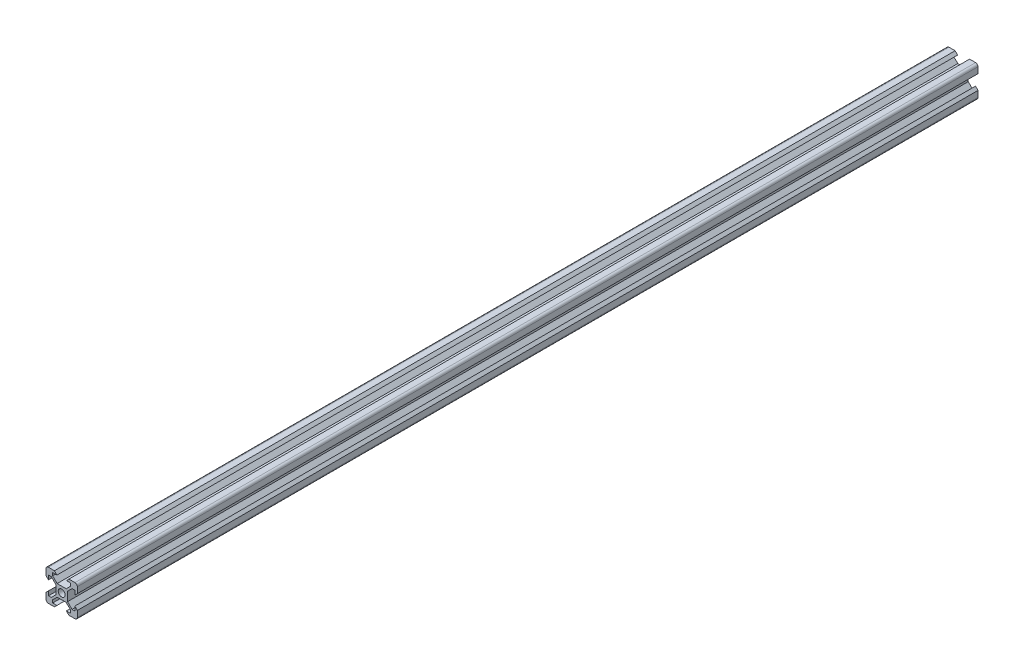
from build123d import *

# Parameters (mm, degrees)
SKETCH1_W           = 15.088
SKETCH1_H           = 15.088
SKETCH1_R           = 4.4
BOSS_EXTRUDE1_DEPTH = 575


with BuildPart() as part:
    # Sketch1 → Boss-Extrude1 (new, symmetric)
    # profile 1 of 5: a face of its own
    with BuildSketch(Plane.XY):
        with BuildLine():
            Line((-7.544, 7.544), (-5.784718328, 7.544))
            Line((-5.784718328, 7.544), (-11.512, 13.271281672))
            Line((-11.512, 13.271281672), (-11.512, 16.8))
            Line((-11.512, 16.8), (-6.051976926, 16.8))
            Line((-6.051976926, 16.8), (-9.251976926, 20))
            Line((-9.251976926, 20), (-17, 20))
            ThreePointArc((-17, 20), (-19.121320344, 19.121320344), (-20, 17))
            Line((-20, 17), (-20, 9.251976926))
            Line((-20, 9.251976926), (-16.8, 6.051976926))
            Line((-16.8, 6.051976926), (-16.8, 11.512))
            Line((-16.8, 11.512), (-13.271281672, 11.512))
            Line((-13.271281672, 11.512), (-7.544, 5.784718328))
            Line((-7.544, 5.784718328), (-7.544, 7.544))
        make_face()
    # profile 2 of 5: a face of its own
    with BuildSketch(Plane.XY):
        with BuildLine():
            Line((11.512, 13.271281672), (5.784718328, 7.544))
            Line((5.784718328, 7.544), (7.544, 7.544))
            Line((7.544, 7.544), (7.544, 5.784718328))
            Line((7.544, 5.784718328), (13.271281672, 11.512))
            Line((13.271281672, 11.512), (16.8, 11.512))
            Line((16.8, 11.512), (16.8, 6.051976926))
            Line((16.8, 6.051976926), (20, 9.251976926))
            Line((20, 9.251976926), (20, 17))
            ThreePointArc((20, 17), (19.121320344, 19.121320344), (17, 20))
            Line((17, 20), (9.251976926, 20))
            Line((9.251976926, 20), (6.051976926, 16.8))
            Line((6.051976926, 16.8), (11.512, 16.8))
            Line((11.512, 16.8), (11.512, 13.271281672))
        make_face()
    # profile 3 of 5: a face of its own
    with BuildSketch(Plane.XY):
        with BuildLine():
            Line((-7.544, -7.544), (-7.544, -5.784718328))
            Line((-7.544, -5.784718328), (-13.271281672, -11.512))
            Line((-13.271281672, -11.512), (-16.8, -11.512))
            Line((-16.8, -11.512), (-16.8, -6.051976926))
            Line((-16.8, -6.051976926), (-20, -9.251976926))
            Line((-20, -9.251976926), (-20, -17))
            ThreePointArc((-20, -17), (-19.121320344, -19.121320344), (-17, -20))
            Line((-17, -20), (-9.251976926, -20))
            Line((-9.251976926, -20), (-6.051976926, -16.8))
            Line((-6.051976926, -16.8), (-11.512, -16.8))
            Line((-11.512, -16.8), (-11.512, -13.271281672))
            Line((-11.512, -13.271281672), (-5.784718328, -7.544))
            Line((-5.784718328, -7.544), (-7.544, -7.544))
        make_face()
    # profile 4 of 5: a face of its own
    with BuildSketch(Plane.XY):
        with BuildLine():
            Line((13.271281672, -11.512), (7.544, -5.784718328))
            Line((7.544, -5.784718328), (7.544, -7.544))
            Line((7.544, -7.544), (5.784718328, -7.544))
            Line((5.784718328, -7.544), (11.512, -13.271281672))
            Line((11.512, -13.271281672), (11.512, -16.8))
            Line((11.512, -16.8), (6.051976926, -16.8))
            Line((6.051976926, -16.8), (9.251976926, -20))
            Line((9.251976926, -20), (17, -20))
            ThreePointArc((17, -20), (19.121320344, -19.121320344), (20, -17))
            Line((20, -17), (20, -9.251976926))
            Line((20, -9.251976926), (16.8, -6.051976926))
            Line((16.8, -6.051976926), (16.8, -11.512))
            Line((16.8, -11.512), (13.271281672, -11.512))
        make_face()
    # profile 5 of 5: a face of its own
    with BuildSketch(Plane.XY):
        Rectangle(SKETCH1_W, SKETCH1_H)
        Circle(SKETCH1_R, mode=Mode.SUBTRACT)
    extrude(amount=BOSS_EXTRUDE1_DEPTH, both=True)


solid = part.part
